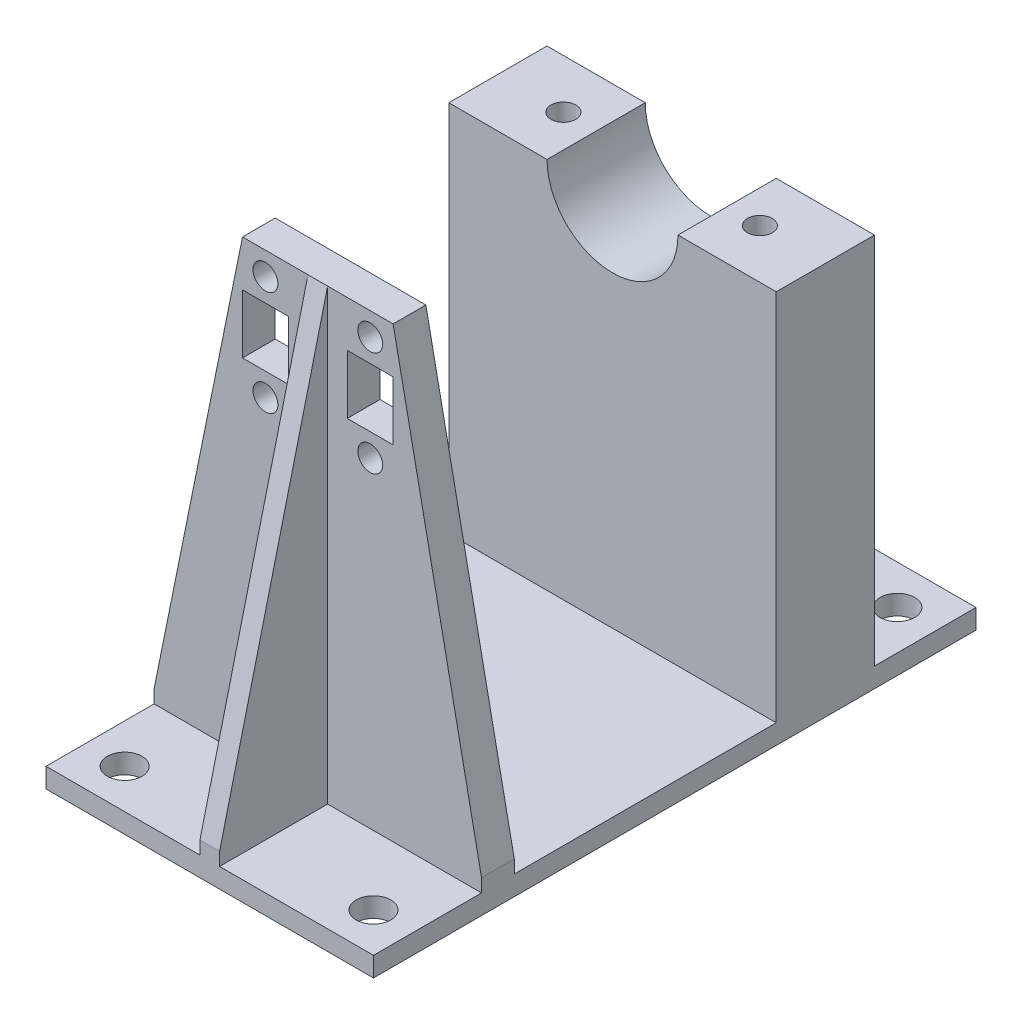
from build123d import *

# Parameters (mm, degrees)
MOTOR_MOUNT_SOLID_DEPTH              = 7.5
ENCODER_DISTANCE_SKETCH_W            = 50
ENCODER_DISTANCE_SKETCH_H            = 55
ENCODER_DISTANCE_SOLID_DEPTH         = 5
ENCODER_MOUNT_SKETCH_R               = 1.9
ENCODER_MOUNT_SKETCH_W               = 7
ENCODER_MOUNT_SKETCH_H               = 9
ENCODER_MOUNT_SOLID_DEPTH            = 5
MOTOR_CLAMP_MOUNTING_HOLES_SKETCH_R  = 1.9
MOTOR_CLAMP_MOUNTING_HOLES_CUT_DEPTH = 16
GUSSET_PLATE_SKETCH_W                = 50
GUSSET_PLATE_SKETCH_H                = 5
GUSSET_PLATE_SOLID_DEPTH             = 16.5
GUSSET_SOLID_DEPTH                   = 1.5
MOUNTING_PLATE_SKETCH_W              = 50
MOUNTING_PLATE_SKETCH_H              = 92
MOUNTING_PLATE_SKETCH_R              = 2.65
MOUNTING_PLATE_SOLID_DEPTH           = 5
MOUNTING_HOLES_CUT_DEPTH             = 100.036609393
MOUNTING_HOLES_CUT_DEPTH_BACK        = 100.036609393
MOUNTING_HOLE_SKETCH_R               = 2.65
MOUNTING_PLATE_TRIM_SKETCH_W         = 50
MOUNTING_PLATE_TRIM_SKETCH_H         = 15.5
MOUNTING_PLATE_TRIM_SKETCH_H_2       = 40
MOUNTING_PLATE_TRIM_SKETCH_W_2       = 23.5
MOUNTING_PLATE_TRIM_SKETCH_H_3       = 16.5
MOUNTING_PLATE_TRIM_CUT_DEPTH        = 2


with BuildPart() as part:
    # Mouting Mount Sketch → Motor Mount Solid (new, symmetric)
    with BuildSketch(Plane.XY):
        with BuildLine():
            Line((-25, -55), (25, -55))
            Line((25, -55), (25, 0))
            Line((25, 0), (10, 0))
            ThreePointArc((10, 0), (0, -10), (-10, 0))
            Line((-10, 0), (-25, 0))
            Line((-25, 0), (-25, -55))
        make_face()
    extrude(amount=MOTOR_MOUNT_SOLID_DEPTH, both=True)

    # Encoder Distance Sketch → Encoder Distance Solid (add)
    with BuildSketch(Plane.XZ.offset(55)):
        with Locations((0, 20)):
            Rectangle(ENCODER_DISTANCE_SKETCH_W, ENCODER_DISTANCE_SKETCH_H)
    extrude(amount=ENCODER_DISTANCE_SOLID_DEPTH)

    # Encoder Mount Sketch → Encoder Mount Solid (add)
    with BuildSketch(Plane.XY.offset(47.5)):
        Polygon((-25, -60), (-25, -55), (-11.5, 11.5), (11.5, 11.5), (25, -55), (25, -60), align=None)
        with Locations((-8, 8)):
            Circle(ENCODER_MOUNT_SKETCH_R, mode=Mode.SUBTRACT)
        with Locations((8, 8)):
            Circle(ENCODER_MOUNT_SKETCH_R, mode=Mode.SUBTRACT)
        with Locations((-8, -8)):
            Circle(ENCODER_MOUNT_SKETCH_R, mode=Mode.SUBTRACT)
        with Locations((8, -8)):
            Circle(ENCODER_MOUNT_SKETCH_R, mode=Mode.SUBTRACT)
        with Locations((-8, 0)):
            Rectangle(ENCODER_MOUNT_SKETCH_W, ENCODER_MOUNT_SKETCH_H, mode=Mode.SUBTRACT)
        with Locations((8, 0)):
            Rectangle(ENCODER_MOUNT_SKETCH_W, ENCODER_MOUNT_SKETCH_H, mode=Mode.SUBTRACT)
    extrude(amount=ENCODER_MOUNT_SOLID_DEPTH)

    # Motor Clamp Mounting Holes Sketch → Motor Clamp Mounting Holes Cut (cut)
    with BuildSketch(Plane(origin=(0, 0, 0), x_dir=(1, 0, 0), z_dir=(0, 1, 0))):
        with Locations(Location((-15, 0, 0), (0, 0, 180))):
            Circle(MOTOR_CLAMP_MOUNTING_HOLES_SKETCH_R)
        with Locations(Location((15, 0, 0), (0, 0, 180))):
            Circle(MOTOR_CLAMP_MOUNTING_HOLES_SKETCH_R)
    extrude(amount=-MOTOR_CLAMP_MOUNTING_HOLES_CUT_DEPTH, mode=Mode.SUBTRACT)

    # Gusset Plate Sketch → Gusset Plate Solid (add)
    with BuildSketch(Plane.XY.offset(52.5)):
        with Locations((0, -57.5)):
            Rectangle(GUSSET_PLATE_SKETCH_W, GUSSET_PLATE_SKETCH_H)
    extrude(amount=GUSSET_PLATE_SOLID_DEPTH)

    # Gusset Sketch → Gusset Solid (add, symmetric)
    with BuildSketch(Plane(origin=(0, 0, 0), x_dir=(0, 0, -1), z_dir=(1, 0, 0))):
        Polygon((-52.5, 11.5), (-69, -55), (-52.5, -55), align=None)
    extrude(amount=GUSSET_SOLID_DEPTH, both=True)

    # Mounting Plate Sketch → Mounting Plate Solid (add)
    with BuildSketch(Plane(origin=(0, -55, 0), x_dir=(1, 0, 0), z_dir=(0, 1, 0))):
        with Locations((0, -23)):
            Rectangle(MOUNTING_PLATE_SKETCH_W, MOUNTING_PLATE_SKETCH_H)
        with Locations((-19, -63)):
            Circle(MOUNTING_PLATE_SKETCH_R, mode=Mode.SUBTRACT)
        with Locations((19, -63)):
            Circle(MOUNTING_PLATE_SKETCH_R, mode=Mode.SUBTRACT)
        with Locations(Location((-19, 17, 0), (0, 0, 270))):
            Circle(MOUNTING_PLATE_SKETCH_R, mode=Mode.SUBTRACT)
        with Locations(Location((19, 17, 0), (0, 0, 270))):
            Circle(MOUNTING_PLATE_SKETCH_R, mode=Mode.SUBTRACT)
    extrude(amount=-MOUNTING_PLATE_SOLID_DEPTH)

    # Mounting Hole Sketch → Mounting Holes Cut (cut, two sides: drawn at the far end of the back side and taken through both)
    with BuildSketch(Plane(origin=(0, -55, 0), x_dir=(1, 0, 0), z_dir=(0, 1, 0)).offset(-MOUNTING_HOLES_CUT_DEPTH_BACK)):
        with Locations(Location((-19, 17, 0), (0, 0, 270))):
            Circle(MOUNTING_HOLE_SKETCH_R)
        with Locations(Location((19, 17, 0), (0, 0, 270))):
            Circle(MOUNTING_HOLE_SKETCH_R)
        with Locations(Location((19, -63, 0), (0, 0, 90))):
            Circle(MOUNTING_HOLE_SKETCH_R)
        with Locations(Location((-19, -63, 0), (0, 0, 90))):
            Circle(MOUNTING_HOLE_SKETCH_R)
    extrude(amount=MOUNTING_HOLES_CUT_DEPTH + MOUNTING_HOLES_CUT_DEPTH_BACK, mode=Mode.SUBTRACT)

    # Mounting Plate Trim Sketch → Mounting Plate Trim Cut (cut)
    with BuildSketch(Plane(origin=(0, -55, 0), x_dir=(1, 0, 0), z_dir=(0, 1, 0))):
        with Locations((0, 15.25)):
            Rectangle(MOUNTING_PLATE_TRIM_SKETCH_W, MOUNTING_PLATE_TRIM_SKETCH_H)
        with Locations((0, -27.5)):
            Rectangle(MOUNTING_PLATE_TRIM_SKETCH_W, MOUNTING_PLATE_TRIM_SKETCH_H_2)
        with Locations((13.25, -60.75)):
            Rectangle(MOUNTING_PLATE_TRIM_SKETCH_W_2, MOUNTING_PLATE_TRIM_SKETCH_H_3)
        with Locations((-13.25, -60.75)):
            Rectangle(MOUNTING_PLATE_TRIM_SKETCH_W_2, MOUNTING_PLATE_TRIM_SKETCH_H_3)
    extrude(amount=-MOUNTING_PLATE_TRIM_CUT_DEPTH, mode=Mode.SUBTRACT)


solid = part.part
